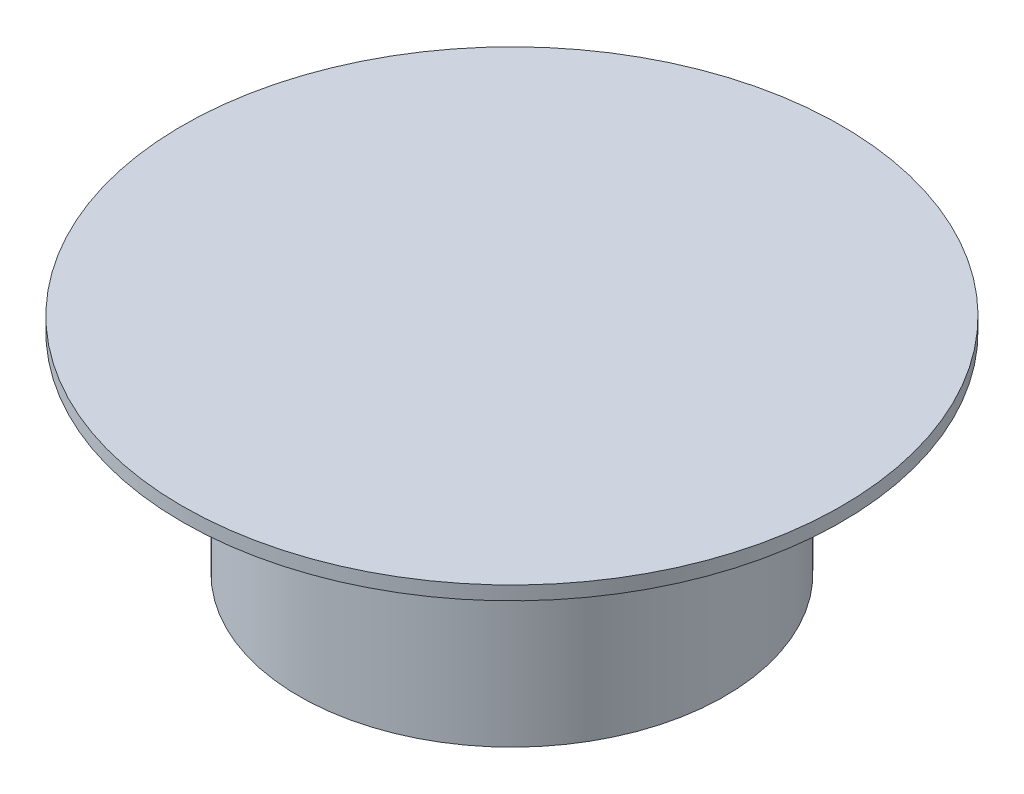
from build123d import *

# Parameters (mm, degrees)
SKETCH1_R           = 3.875
BOSS_EXTRUDE1_DEPTH = 3.81
SKETCH2_R           = 6
BOSS_EXTRUDE2_DEPTH = 0.25


with BuildPart() as part:
    # Sketch1 → Boss-Extrude1 (new body)
    with BuildSketch(Plane(origin=(0, 0, 0), x_dir=(1, 0, 0), z_dir=(0, 1, 0))):
        with Locations(Location((0, 0, 0), (0, 0, 90))):
            Circle(SKETCH1_R)
    extrude(amount=BOSS_EXTRUDE1_DEPTH)

    # Sketch2 → Boss-Extrude2 (add)
    with BuildSketch(Plane(origin=(0, 3.81, 0), x_dir=(1, 0, 0), z_dir=(0, 1, 0))):
        with Locations(Location((0, 0, 0), (0, 0, 270))):
            Circle(SKETCH2_R)
    extrude(amount=BOSS_EXTRUDE2_DEPTH)


solid = part.part
